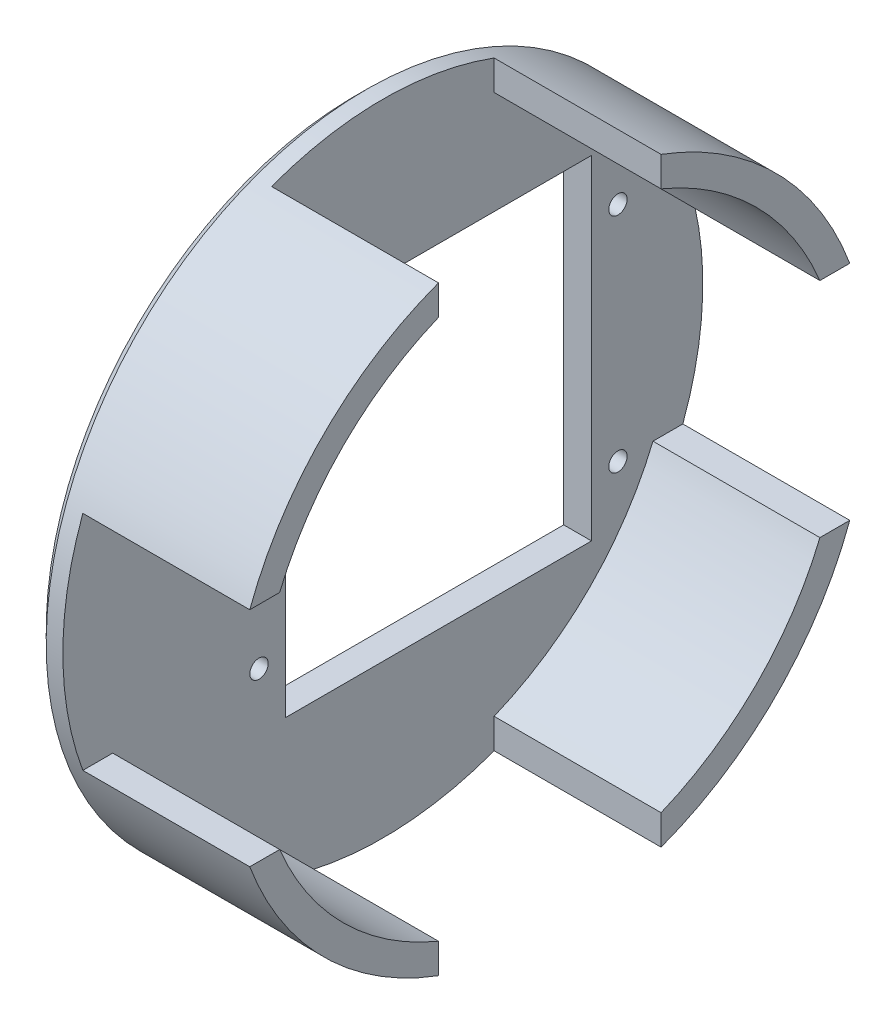
from build123d import *

# Parameters (mm, degrees)
SKETCH_1_R          = 57.5
EXTRUDE_1_DEPTH     = 5
SKETCH_2_R          = 57.5
SKETCH_2_R_2        = 52.5
EXTRUDE_2_DEPTH     = 30
SKETCH_3_R          = 1.65
SKETCH_3_W          = 55
SKETCH_3_H          = 60
CUT_EXTRUDE_1_DEPTH = 87.674679117
CUT_EXTRUDE_START   = -30
CUT_EXTRUDE_2_DEPTH = 30
CHAMFER_1_SIZE      = 2


with BuildPart() as part:
    # ｽｹｯﾁ1 → ﾎﾞｽ - 押し出し1 (new body)
    with BuildSketch(Plane(origin=(0, 0, 0), x_dir=(0, 0, -1), z_dir=(1, 0, 0))):
        Circle(SKETCH_1_R)
    extrude(amount=EXTRUDE_1_DEPTH)

    # ｽｹｯﾁ2 → ﾎﾞｽ - 押し出し2 (add)
    with BuildSketch(Plane(origin=(5, 0, 0), x_dir=(0, 0, -1), z_dir=(1, 0, 0))):
        Circle(SKETCH_2_R)
        Circle(SKETCH_2_R_2, mode=Mode.SUBTRACT)
    extrude(amount=EXTRUDE_2_DEPTH)

    # ｽｹｯﾁ3 → ｶｯﾄ - 押し出し1 (cut, through all)
    with BuildSketch(Plane(origin=(5, 0, 0), x_dir=(0, 0, -1), z_dir=(1, 0, 0))):
        with Locations((-22.25, 20)):
            Circle(SKETCH_3_R)
        with Locations(Location((-22.25, -20, 0), (0, 0, 180))):
            Circle(SKETCH_3_R)
        with Locations(Location((42.25, 20, 0), (0, 0, 180))):
            Circle(SKETCH_3_R)
        with Locations((42.25, -20)):
            Circle(SKETCH_3_R)
        with Locations((10, 0)):
            Rectangle(SKETCH_3_W, SKETCH_3_H)
    extrude(amount=-CUT_EXTRUDE_1_DEPTH, mode=Mode.SUBTRACT)

    # ｽｹｯﾁ4 → ｶｯﾄ - 押し出し2 (cut)
    with BuildSketch(Plane(origin=(35, 0, 0), x_dir=(0, 0, -1), z_dir=(1, 0, 0)).offset(CUT_EXTRUDE_START)):
        with BuildLine():
            ThreePointArc((20, 53.909646632), (0, 57.5), (-20, 53.909646632))
            Line((-20, 53.909646632), (-20, 48.541219597))
            ThreePointArc((-20, 48.541219597), (0, 52.5), (20, 48.541219597))
            Line((20, 48.541219597), (20, 53.909646632))
        make_face()
        with BuildLine():
            Line((-48.541219597, 20), (-53.909646632, 20))
            ThreePointArc((-53.909646632, 20), (-57.5, 0), (-53.909646632, -20))
            Line((-53.909646632, -20), (-48.541219597, -20))
            ThreePointArc((-48.541219597, -20), (-52.5, 0), (-48.541219597, 20))
        make_face()
        with BuildLine():
            Line((53.909646632, 20), (48.541219597, 20))
            ThreePointArc((48.541219597, 20), (52.5, 0), (48.541219597, -20))
            Line((48.541219597, -20), (53.909646632, -20))
            ThreePointArc((53.909646632, -20), (57.5, 0), (53.909646632, 20))
        make_face()
        with BuildLine():
            Line((-20, -48.541219597), (-20, -53.909646632))
            ThreePointArc((-20, -53.909646632), (0, -57.5), (20, -53.909646632))
            Line((20, -53.909646632), (20, -48.541219597))
            ThreePointArc((20, -48.541219597), (0, -52.5), (-20, -48.541219597))
        make_face()
    extrude(amount=CUT_EXTRUDE_2_DEPTH, mode=Mode.SUBTRACT)

    # 面取り1
    chamfer_1_edges = [part.edges().sort_by_distance(p)[0] for p in [
        (0, 0, 57.5),
    ]]
    chamfer(chamfer_1_edges, length=CHAMFER_1_SIZE)


solid = part.part
